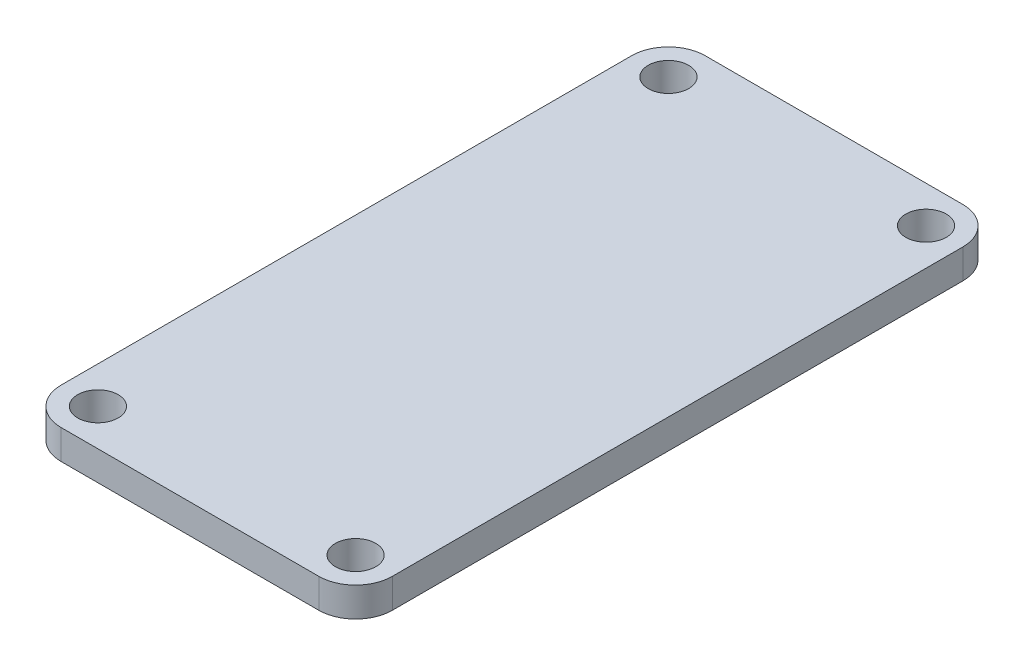
from build123d import *

# Parameters (mm, degrees)
SKETCH_1_W          = 18
SKETCH_1_H          = 35
EXTRUDE_1_DEPTH     = 1.6
SKETCH_2_R          = 1.1
CUT_EXTRUDE_1_DEPTH = 20.74360656
FILLET_2_R          = 2


with BuildPart() as part:
    # 草图1 → 凸台-拉伸1 (new body)
    with BuildSketch(Plane(origin=(0, 0, 0), x_dir=(1, 0, 0), z_dir=(0, 1, 0))):
        Rectangle(SKETCH_1_W, SKETCH_1_H)
    extrude(amount=EXTRUDE_1_DEPTH)

    # 草图2 → 切除-拉伸1 (cut, through all)
    with BuildSketch(Plane(origin=(0, 1.6, 0), x_dir=(1, 0, 0), z_dir=(0, 1, 0))):
        with Locations(Location((-7, 15.5, 0), (0, 0, 270))):
            Circle(SKETCH_2_R)
        with Locations(Location((7, 15.5, 0), (0, 0, 90))):
            Circle(SKETCH_2_R)
        with Locations(Location((7, -15.5, 0), (0, 0, 270))):
            Circle(SKETCH_2_R)
        with Locations(Location((-7, -15.5, 0), (0, 0, 90))):
            Circle(SKETCH_2_R)
    extrude(amount=-CUT_EXTRUDE_1_DEPTH, mode=Mode.SUBTRACT)

    # 圆角2
    fillet_2_edges = [part.edges().sort_by_distance(p)[0] for p in [
        (9, 0.8, 17.5),
        (-9, 0.8, 17.5),
        (-9, 0.8, -17.5),
        (9, 0.8, -17.5),
    ]]
    fillet(fillet_2_edges, radius=FILLET_2_R)


solid = part.part
